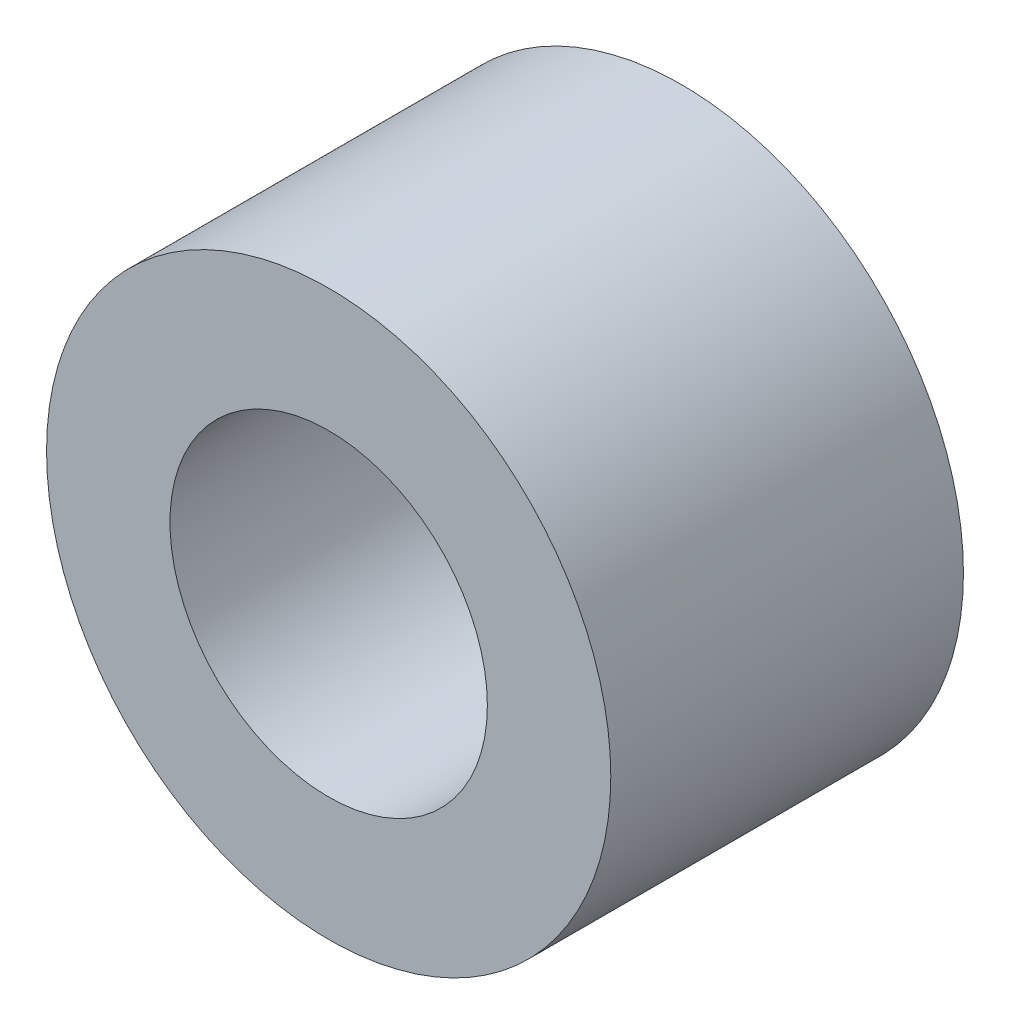
from build123d import *

# Parameters (mm, degrees)
SKETCH_1_R           = 4
CABLE_BULKHEAD_DEPTH = 5
SKETCH_2_R           = 2.25
CABLE_PASSAGE_DEPTH  = 8.549834435


with BuildPart() as part:
    # 草图1 → Cable_bulkhead (new body)
    with BuildSketch(Plane.XY):
        Circle(SKETCH_1_R)
    extrude(amount=CABLE_BULKHEAD_DEPTH)

    # 草图2 → Cable_passage (cut, through all)
    with BuildSketch(Plane.XY.offset(5)):
        Circle(SKETCH_2_R)
    extrude(amount=-CABLE_PASSAGE_DEPTH, mode=Mode.SUBTRACT)


solid = part.part
